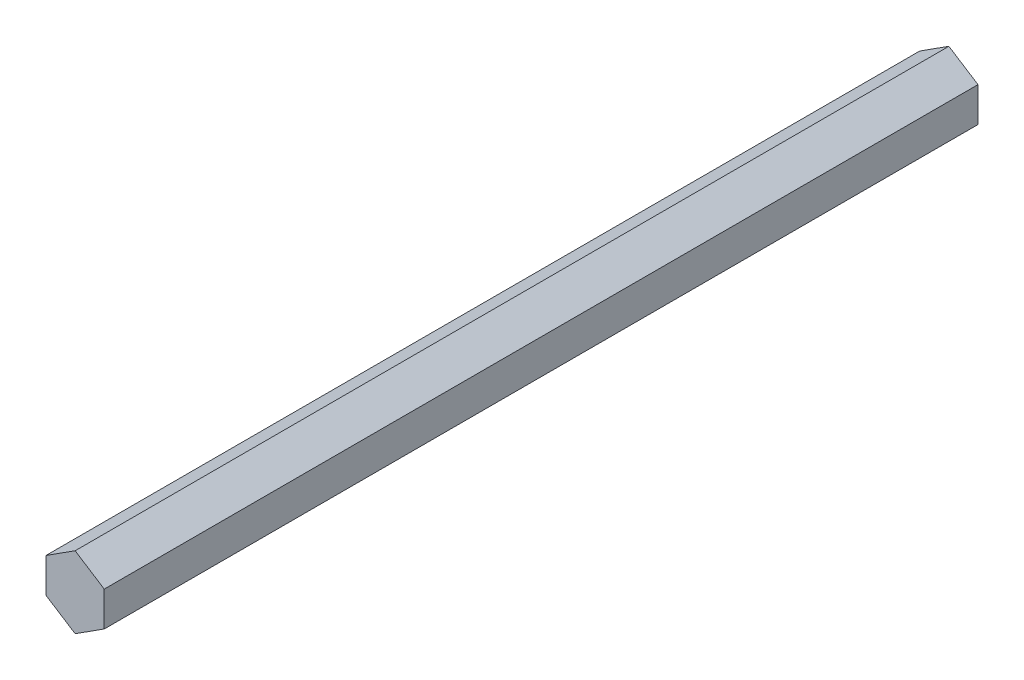
from build123d import *

# Parameters (mm, degrees)
BOSS_EXTRUDE1_DEPTH = 114.3


with BuildPart() as part:
    # Sketch1 → Boss-Extrude1 (new body)
    with BuildSketch(Plane(origin=(0, 0, 0), x_dir=(0, 1, 0), z_dir=(0, 0, 1))):
        Polygon((0, 0), (4.522998019, 0), (6.960499009, 3.81), (4.522998019, 7.62), (0, 7.62), (-2.437500991, 3.81), align=None)
    extrude(amount=BOSS_EXTRUDE1_DEPTH)


solid = part.part
